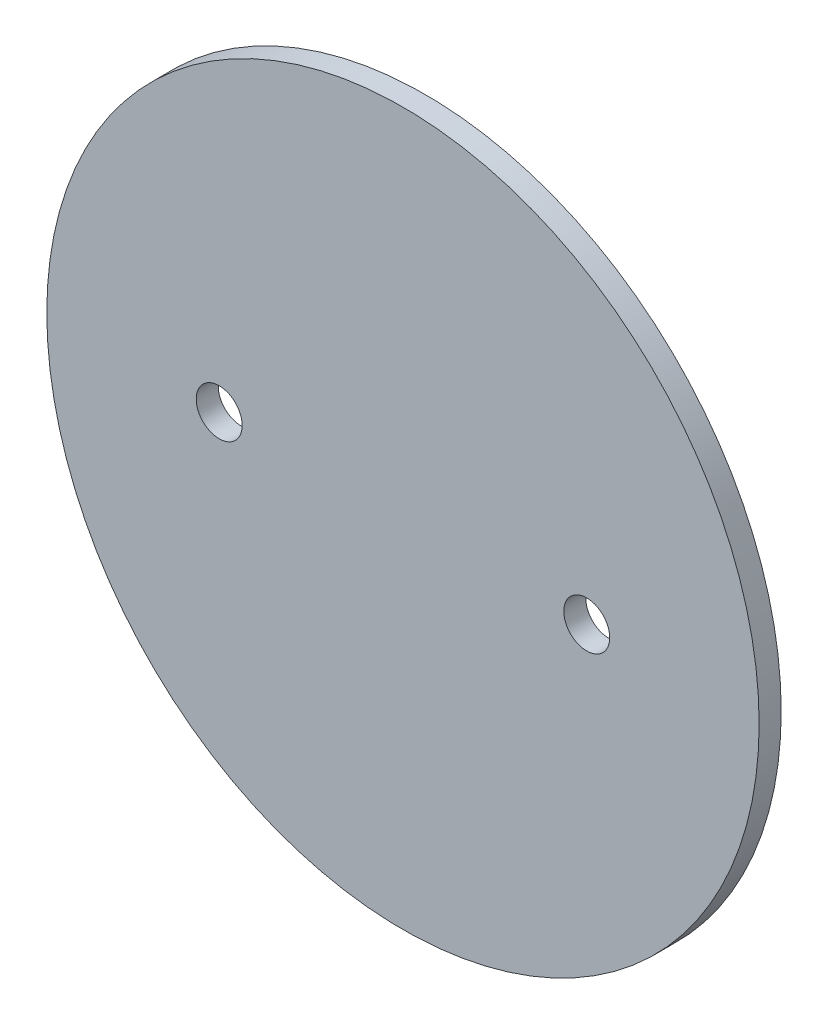
from build123d import *

# Parameters (mm, degrees)
SKETCH1_R           = 96.9
SKETCH1_R_2         = 6.25
BOSS_EXTRUDE1_DEPTH = 3


with BuildPart() as part:
    # Sketch1 → Boss-Extrude1 (new, symmetric)
    with BuildSketch(Plane.XY):
        Circle(SKETCH1_R)
        with Locations((-50, 0)):
            Circle(SKETCH1_R_2, mode=Mode.SUBTRACT)
        with Locations((50, 0)):
            Circle(SKETCH1_R_2, mode=Mode.SUBTRACT)
    extrude(amount=BOSS_EXTRUDE1_DEPTH, both=True)


solid = part.part
